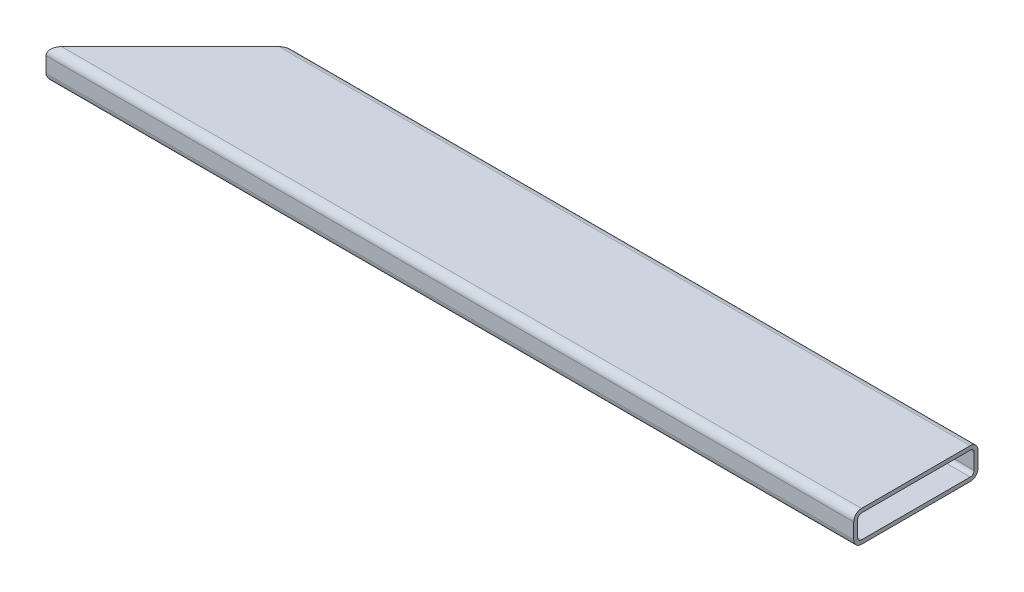
from build123d import *

# Parameters (mm, degrees)
SKETCH1_W           = 101.6
SKETCH1_H           = 25.4
BOSS_EXTRUDE1_DEPTH = 660.4
FILLET1_R           = 6.35
SHELL1_T            = -3.175
CUT_EXTRUDE1_DEPTH  = 25.4


with BuildPart() as part:
    # Sketch1 → Boss-Extrude1 (new body)
    with BuildSketch(Plane(origin=(0, 0, 0), x_dir=(0, 0, -1), z_dir=(1, 0, 0))):
        with Locations((50.8, 12.7)):
            Rectangle(SKETCH1_W, SKETCH1_H)
    extrude(amount=BOSS_EXTRUDE1_DEPTH)

    # Fillet1
    fillet1_edges = [part.edges().sort_by_distance(p)[0] for p in [
        (330.2, 0, 0),
        (330.2, 0, -101.6),
        (330.2, 25.4, -101.6),
        (330.2, 25.4, 0),
    ]]
    fillet(fillet1_edges, radius=FILLET1_R)

    # Shell1
    shell1_openings = [part.faces().sort_by_distance(p)[0] for p in [
        (0, 12.7, -50.8),
        (660.4, 12.7, -50.8),
    ]]
    offset(amount=SHELL1_T, openings=shell1_openings, kind=Kind.INTERSECTION)

    # Sketch2 → Cut-Extrude1 (cut)
    with BuildSketch(Plane(origin=(0, 25.4, 0), x_dir=(1, 0, 0), z_dir=(0, 1, 0))):
        Polygon((0, 0), (101.6, 101.6), (0, 101.6), align=None)
    extrude(amount=-CUT_EXTRUDE1_DEPTH, mode=Mode.SUBTRACT)


solid = part.part
